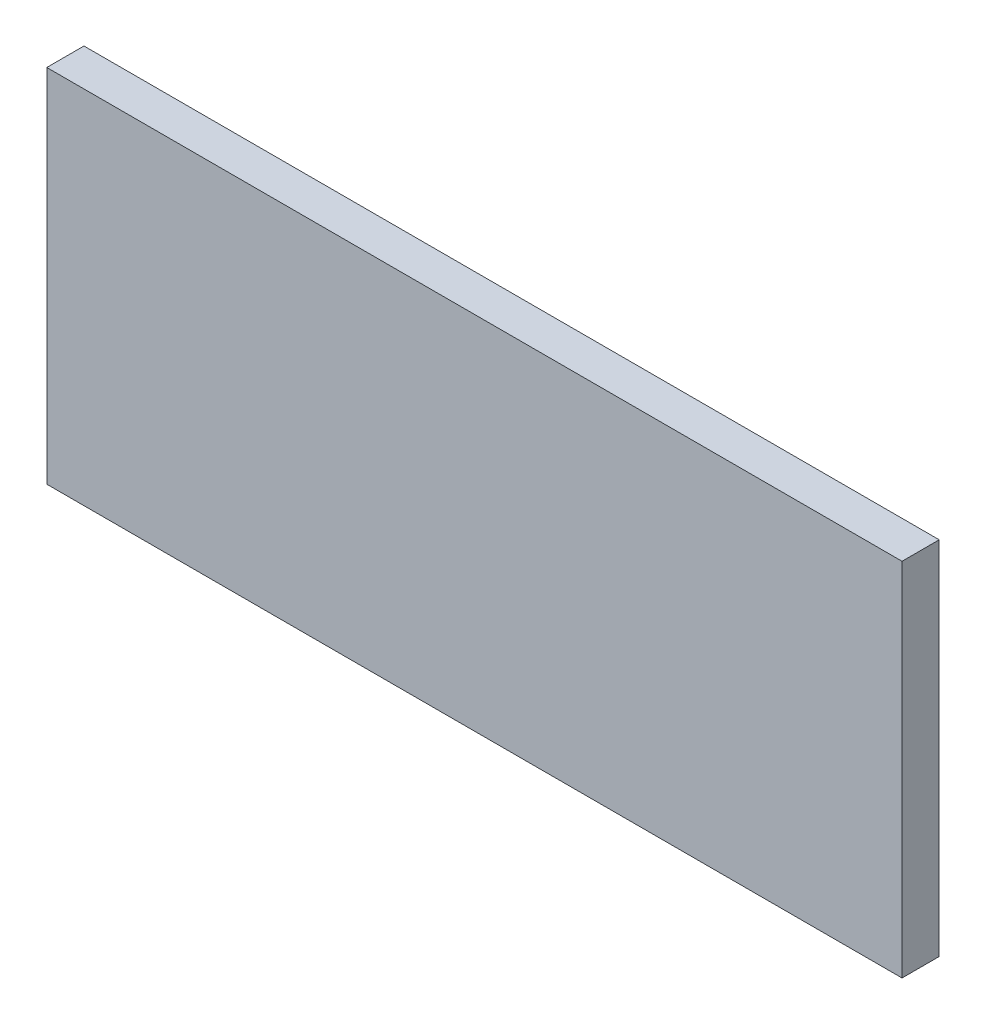
from build123d import *

# Parameters (mm, degrees)
SKETCH1_W           = 4600
SKETCH1_H           = 1941.19
BOSS_EXTRUDE1_DEPTH = 200


with BuildPart() as part:
    # Sketch1 → Boss-Extrude1 (new body)
    with BuildSketch(Plane.XY):
        with Locations((573.089700997, 1352.32858804)):
            Rectangle(SKETCH1_W, SKETCH1_H)
    extrude(amount=BOSS_EXTRUDE1_DEPTH)


solid = part.part
